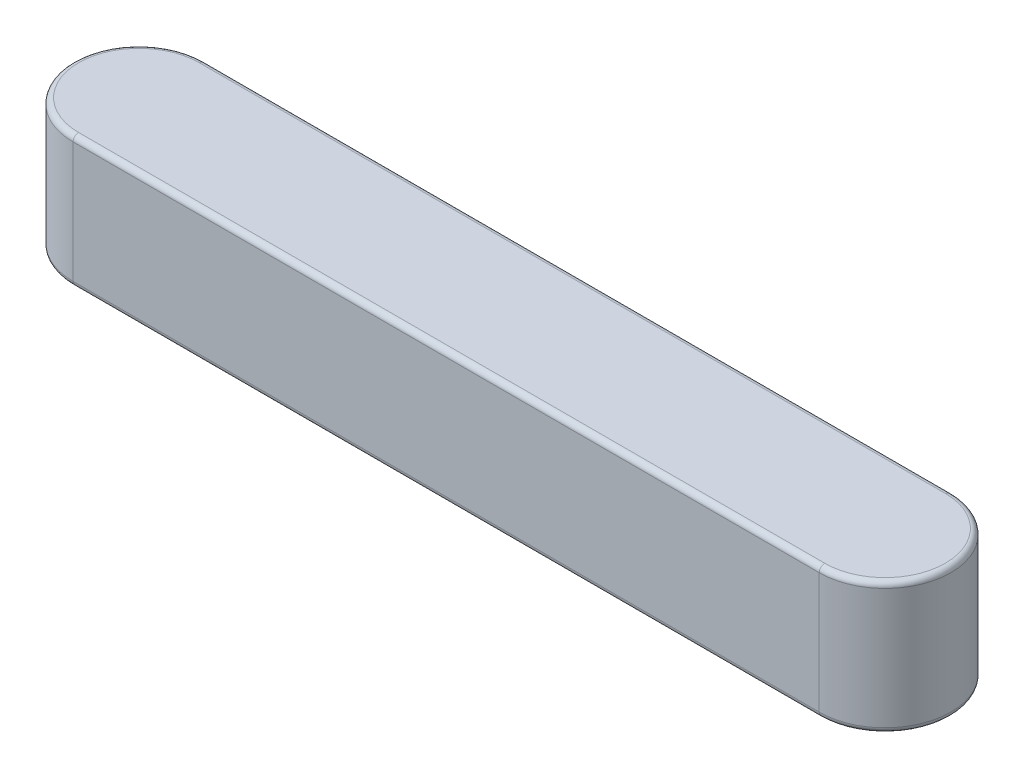
from build123d import *

# Parameters (mm, degrees)
EXTRUDE1_DEPTH = 6
FILLET1_R      = 0.25


with BuildPart() as part:
    # Sketch1 → Extrude1 (new body)
    with BuildSketch(Plane(origin=(0, 0, 0), x_dir=(1, 0, 0), z_dir=(0, 1, 0))):
        with BuildLine():
            Line((-34, 3), (0, 3))
            ThreePointArc((0, 3), (3, 0), (0, -3))
            Line((0, -3), (-34, -3))
            ThreePointArc((-34, -3), (-37, 0), (-34, 3))
        make_face()
    extrude(amount=EXTRUDE1_DEPTH)

    # Fillet1
    fillet1_edges = [part.edges().sort_by_distance(p)[0] for p in [
        (3, 6, 0),
        (-17, 6, -3),
        (-37, 6, 0),
        (-17, 0, -3),
        (3, 0, 0),
        (-17, 0, 3),
        (-37, 0, 0),
        (-17, 6, 3),
    ]]
    fillet(fillet1_edges, radius=FILLET1_R)


solid = part.part
